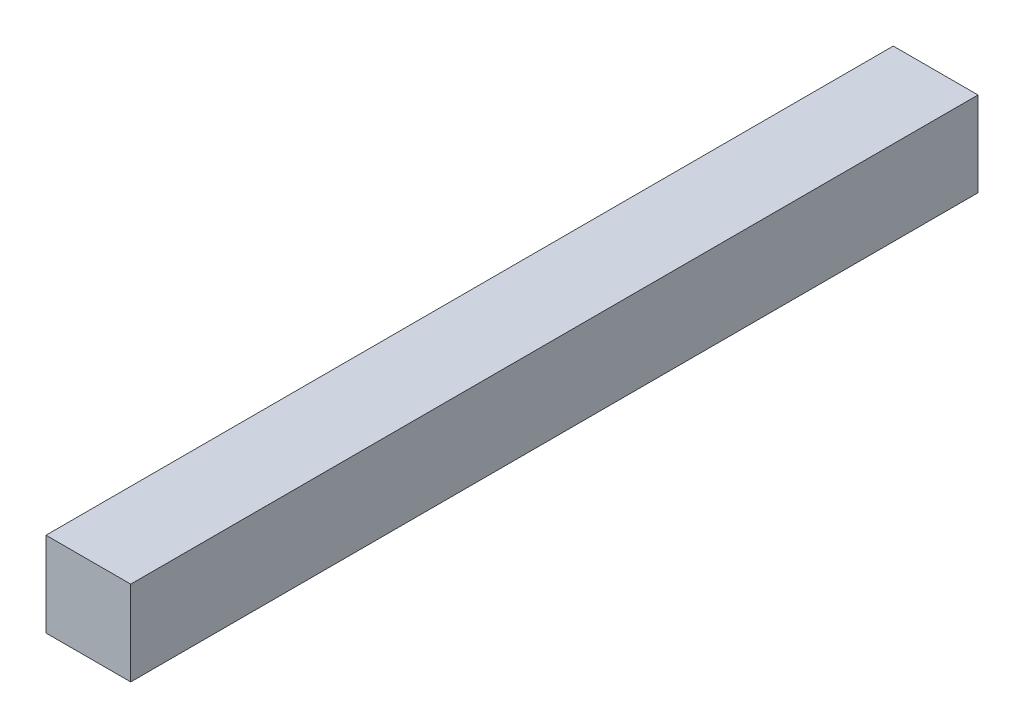
from build123d import *

# Parameters (mm, degrees)
SKETCH1_W           = 10
SKETCH1_H           = 10
BOSS_EXTRUDE1_DEPTH = 100


with BuildPart() as part:
    # Sketch1 → Boss-Extrude1 (new body)
    with BuildSketch(Plane.XY):
        with Locations((5, 5)):
            Rectangle(SKETCH1_W, SKETCH1_H)
    extrude(amount=BOSS_EXTRUDE1_DEPTH)


solid = part.part
